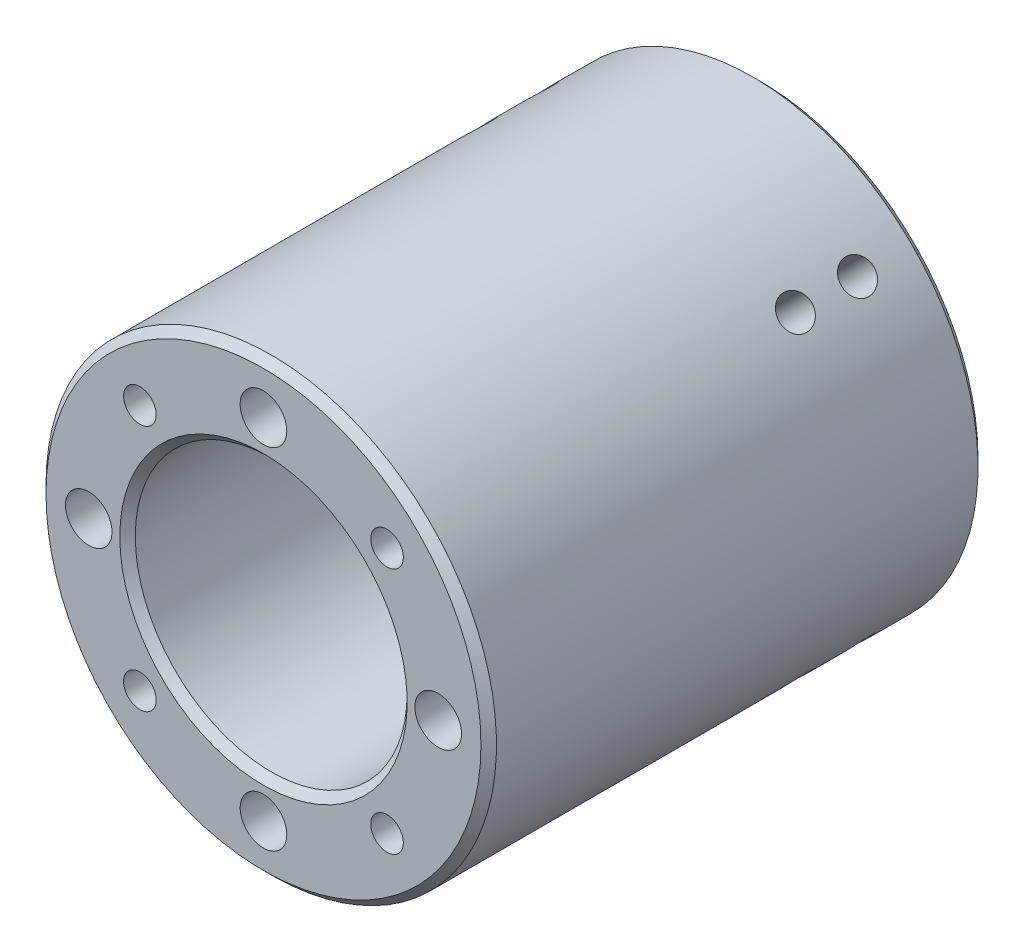
from build123d import *

# Parameters (mm, degrees)
PATTERN_CIRCULAR_1_COUNT           = 4
CHAMFER_1_SIZE                     = 1
CHAMFER_2_SIZE                     = 1
MM_1_D                             = 6
MM_1_DEPTH                         = 6
MM_1_TIP                           = 1.802581857
SKETCH_12_W                        = 2.1
SKETCH_12_H                        = 41.012198951
HOLE_WIZARD_M5_2_AT_2_COUNT        = 2
HOLE_WIZARD_M5_2_AT_2_PITCH        = 8
PATTERN_CIRCULAR_3_COUNT           = 4
PATTERN_CIRCULAR_3_COPY_1_SKETCH_W = 2.1
PATTERN_CIRCULAR_3_COPY_1_SKETCH_H = 41.012198951
PATTERN_CIRCULAR_3_COPY_2_SKETCH_W = 2.1
PATTERN_CIRCULAR_3_COPY_2_SKETCH_H = 41.012198951
PATTERN_CIRCULAR_3_COPY_3_SKETCH_W = 2.1
PATTERN_CIRCULAR_3_COPY_3_SKETCH_H = 41.012198951


with BuildPart() as part:
    # 草图1 → 旋转1 (revolve)
    with BuildSketch(Plane(origin=(0, 0, 0), x_dir=(0, 0, -1), z_dir=(1, 0, 0)), mode=Mode.PRIVATE) as revolve_1_sk:
        Polygon((64, 29), (64, 10), (40, 10), (40, 17.5), (0, 17.5), (0, 29), align=None)
    revolve(revolve_1_sk.sketch.rotate(Axis((0, 0, 74.600938967), (0, 0, -1)), 90), axis=Axis((0, 0, 74.600938967), (0, 0, -1)))

    # 草图5 → M5 螺纹孔1 (revolve, cut)
    with BuildSketch(Plane(origin=(15.909902577, 15.909902577, 0), x_dir=(0, -1, 0), z_dir=(1, 0, 0))):
        Polygon((0, 0), (0, 15.2618073), (2.1, 14), (2.1, 0), align=None)
    hole_wizard_m5_1 = revolve(axis=Axis((15.909902577, 15.909902577, 6.35), (0, 0, -1)), mode=Mode.SUBTRACT)

    # 阵列(圆周)1: M5 螺纹孔1 ×4 about axis
    pattern_circular_1_axis = Axis((0, 0, 0), (0, 0, 1))
    for i in range(1, PATTERN_CIRCULAR_1_COUNT):
        add(hole_wizard_m5_1.rotate(pattern_circular_1_axis, i * 360 / PATTERN_CIRCULAR_1_COUNT), mode=Mode.SUBTRACT)

    # 倒角1
    chamfer_1_edges = [part.edges().sort_by_distance(p)[0] for p in [
        (-29, 0, 0),
        (-29, 0, -64),
    ]]
    chamfer(chamfer_1_edges, length=CHAMFER_1_SIZE)

    # 倒角2
    chamfer_2_edges = [part.edges().sort_by_distance(p)[0] for p in [
        (-10, 0, -64),
        (-10, 0, -40),
        (-17.5, 0, 0),
    ]]
    chamfer(chamfer_2_edges, length=CHAMFER_2_SIZE)

    # 大小mm 暗销孔1
    with Locations(Plane.XY):
        with Locations((0, -22.5), (-22.5, 0), (0, 22.5), (22.5, 0)):
            Hole(MM_1_D / 2, depth=MM_1_DEPTH)
            with Locations((0, 0, -(MM_1_DEPTH + MM_1_TIP / 2))):  # 118° drill point
                Cone(0, MM_1_D / 2, MM_1_TIP, mode=Mode.SUBTRACT)

    # 草图12 → M5 螺纹孔2 (revolve, cut)
    with BuildSketch(Plane(origin=(-2.992e-06, 2.992e-06, -48), x_dir=(-0.4082482226009898, -0.4082483243953038, 0.8164965978934386), z_dir=(0.5773503171759193, 0.5773502451964775, 0.5773502451964775))):
        with Locations((1.05, 20.506099476)):
            Rectangle(SKETCH_12_W, SKETCH_12_H)
    hole_wizard_m5_2 = revolve(axis=Axis((-4.490131053, 4.490131053, -47.99999944), (0.7071067811865461, -0.7071067811865434, -8.815645872088268e-08)), mode=Mode.SUBTRACT)

    # M5 螺纹孔2 at 2: M5 螺纹孔2 ×2
    with Locations(*[(0, 0, -i * HOLE_WIZARD_M5_2_AT_2_PITCH) for i in range(1, HOLE_WIZARD_M5_2_AT_2_COUNT)]):
        add(hole_wizard_m5_2, mode=Mode.SUBTRACT)

    # 阵列(圆周)3: M5 螺纹孔2 ×4 about axis
    pattern_circular_3_axis = Axis((0, 0, -63), (0, 0, -1))
    for i in range(1, PATTERN_CIRCULAR_3_COUNT):
        add(hole_wizard_m5_2.rotate(pattern_circular_3_axis, i * 360 / PATTERN_CIRCULAR_3_COUNT), mode=Mode.SUBTRACT)

    # 阵列(圆周)3 copy 1 sketch → 阵列(圆周)3 copy 1 (revolve, cut)
    with BuildSketch(Plane(origin=(3.491e-06, 3.491e-06, -56), x_dir=(-0.4082483243953038, 0.4082482226009898, 0.8164965978934386), z_dir=(0.5773502451964775, -0.5773503171759193, 0.5773502451964775))):
        with Locations((1.05, 20.506099476)):
            Rectangle(PATTERN_CIRCULAR_3_COPY_1_SKETCH_W, PATTERN_CIRCULAR_3_COPY_1_SKETCH_H)
    revolve(axis=Axis((4.490131551, 4.490131551, -55.99999944), (-0.7071067811865434, -0.7071067811865461, -8.815645872088268e-08)), mode=Mode.SUBTRACT)

    # 阵列(圆周)3 copy 2 sketch → 阵列(圆周)3 copy 2 (revolve, cut)
    with BuildSketch(Plane(origin=(3.491e-06, -3.491e-06, -56), x_dir=(0.40824822260098975, 0.40824832439530384, 0.8164965978934386), z_dir=(-0.5773503171759192, -0.5773502451964776, 0.5773502451964775))):
        with Locations((1.05, 20.506099476)):
            Rectangle(PATTERN_CIRCULAR_3_COPY_2_SKETCH_W, PATTERN_CIRCULAR_3_COPY_2_SKETCH_H)
    revolve(axis=Axis((4.490131551, -4.490131551, -55.99999944), (-0.7071067811865462, 0.7071067811865432, -8.815645872088268e-08)), mode=Mode.SUBTRACT)

    # 阵列(圆周)3 copy 3 sketch → 阵列(圆周)3 copy 3 (revolve, cut)
    with BuildSketch(Plane(origin=(-3.491e-06, -3.491e-06, -56), x_dir=(0.40824832439530384, -0.40824822260098975, 0.8164965978934386), z_dir=(-0.5773502451964776, 0.5773503171759192, 0.5773502451964775))):
        with Locations((1.05, 20.506099476)):
            Rectangle(PATTERN_CIRCULAR_3_COPY_3_SKETCH_W, PATTERN_CIRCULAR_3_COPY_3_SKETCH_H)
    revolve(axis=Axis((-4.490131551, -4.490131551, -55.99999944), (0.7071067811865432, 0.7071067811865462, -8.815645872088268e-08)), mode=Mode.SUBTRACT)


solid = part.part
